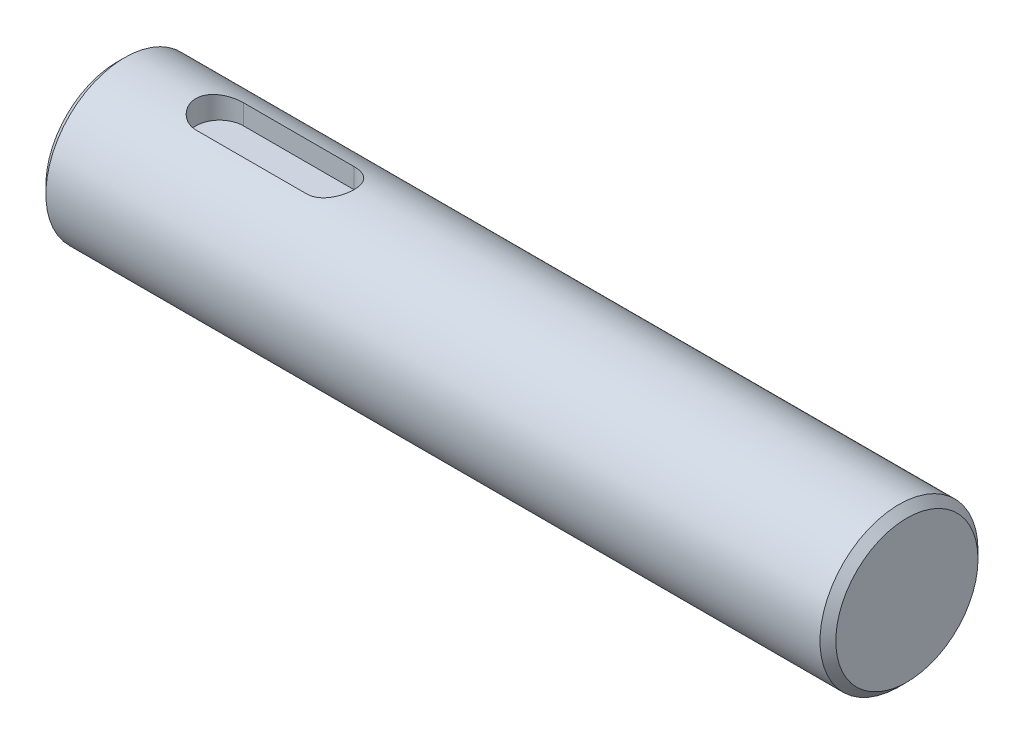
from build123d import *

# Parameters (mm, degrees)
SKETCH_1_R          = 10
EXTRUDE_1_DEPTH     = 100
CUT_EXTRUDE_1_DEPTH = 3
CHAMFER_1_SIZE      = 1
CHAMFER_2_SIZE      = 1


with BuildPart() as part:
    # 草图1 → 凸台-拉伸1 (new body)
    with BuildSketch(Plane(origin=(0, 0, 0), x_dir=(0, 0, -1), z_dir=(1, 0, 0))):
        Circle(SKETCH_1_R)
    extrude(amount=EXTRUDE_1_DEPTH)

    # 草图2 → 切除-拉伸1 (cut)
    with BuildSketch(Plane(origin=(0, 10, 0), x_dir=(1, 0, 0), z_dir=(0, 1, 0))):
        with BuildLine():
            Line((13, 3), (27, 3))
            ThreePointArc((27, 3), (30, 0), (27, -3))
            Line((27, -3), (13, -3))
            ThreePointArc((13, -3), (10, 0), (13, 3))
        make_face()
    extrude(amount=-CUT_EXTRUDE_1_DEPTH, mode=Mode.SUBTRACT)

    # 倒角1
    chamfer_1_edges = [part.edges().sort_by_distance(p)[0] for p in [
        (0, 0, 10),
    ]]
    chamfer(chamfer_1_edges, length=CHAMFER_1_SIZE)

    # 倒角2
    chamfer_2_edges = [part.edges().sort_by_distance(p)[0] for p in [
        (100, 0, 10),
    ]]
    chamfer(chamfer_2_edges, length=CHAMFER_2_SIZE)


solid = part.part
